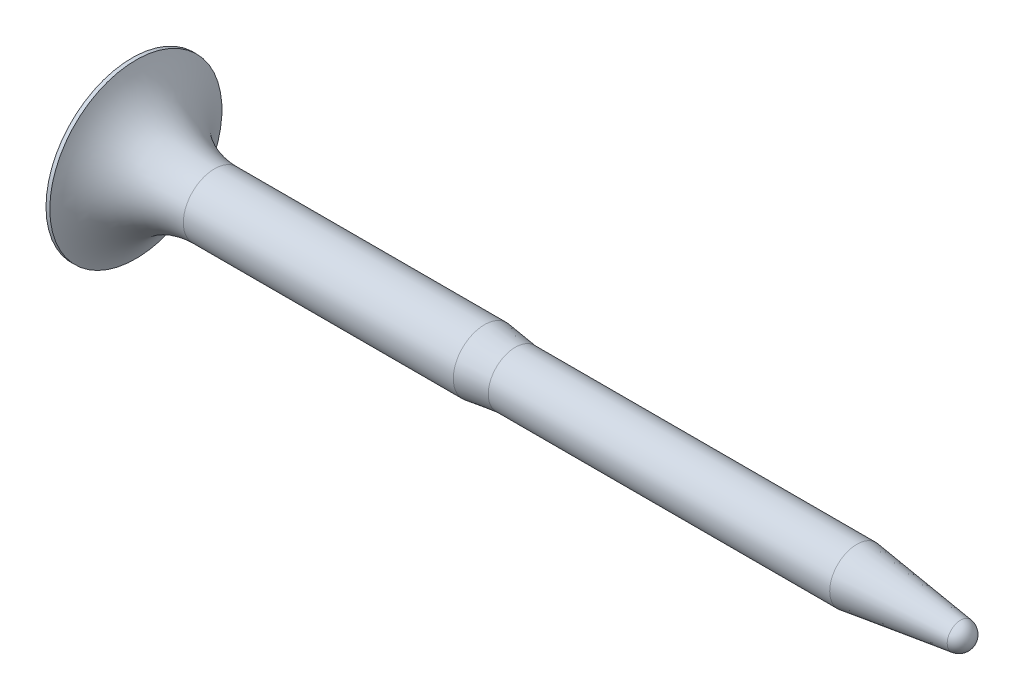
from build123d import *


with BuildPart() as part:
    # Sketch1 → Revolve1 (revolve)
    with BuildSketch(Plane.XY, mode=Mode.PRIVATE) as revolve1_sk:
        with BuildLine():
            Line((0, -4.03225), (0, 0))
            Line((0, 0), (39.37, 0))
            ThreePointArc((39.37, 0), (39.212418278, -0.418684593), (38.817884132, -0.629567487))
            Line((38.817884132, -0.629567487), (33.953316237, -1.27))
            Line((33.953316237, -1.27), (17.956991158, -1.27))
            Line((17.956991158, -1.27), (16.51, -1.4605))
            Line((16.51, -1.4605), (3.8608, -1.4605))
            ThreePointArc((3.8608, -1.4605), (1.61478202, -2.167065301), (0.1778, -4.03225))
            Line((0.1778, -4.03225), (0, -4.03225))
        make_face()
    revolve(revolve1_sk.sketch.rotate(Axis((0, 0, 0), (1, 0, 0)), 270), axis=Axis((0, 0, 0), (1, 0, 0)))


solid = part.part
